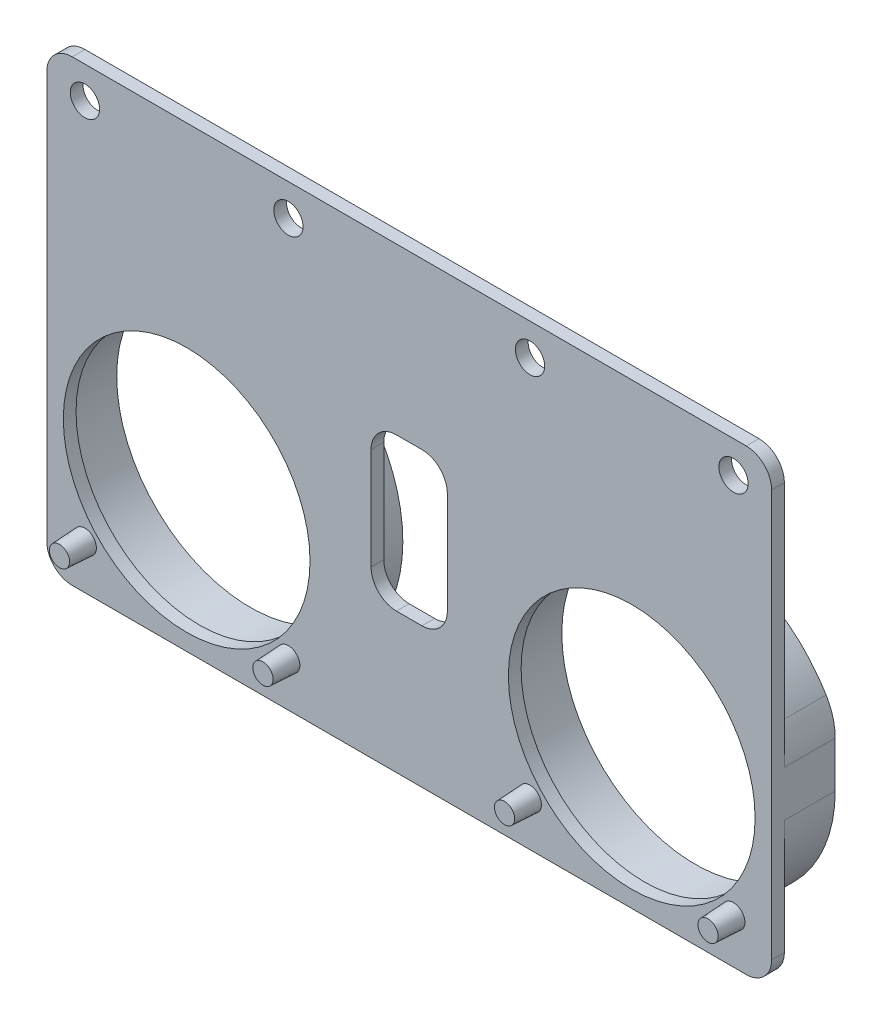
from build123d import *

# Parameters (mm, degrees)
SKETCH_1_W                = 57
SKETCH_1_H                = 36
SKETCH_1_R                = 9.7
SKETCH_1_R_2              = 1.15
SKETCH_1_W_2              = 6
SKETCH_1_H_2              = 12
EXTRUDE_1_DEPTH           = 1
FILLET_1_R                = 2
FILLET_2_R                = 2
SKETCH_2_R                = 0.9
EXTRUDE_2_DEPTH           = 2
EXTRUDE_2_DRAFT           = 3
EXTRUDE_2_PROFILE_2_DEPTH = 2
EXTRUDE_2_PROFILE_2_DRAFT = 3
MIRROR_1_COPY_1_SKETCH_R  = 0.9
MIRROR_1_COPY_1_DEPTH     = 2
MIRROR_1_COPY_1_DRAFT     = 3
MIRROR_1_COPY_2_SKETCH_R  = 0.9
MIRROR_1_COPY_2_DEPTH     = 2
MIRROR_1_COPY_2_DRAFT     = 3
MIRROR_1_COPY_3_SKETCH_R  = 0.9
MIRROR_1_COPY_3_DEPTH     = 2
MIRROR_1_COPY_3_DRAFT     = 3
SKETCH_3_R                = 10.5
EXTRUDE_3_DEPTH           = 4
FILLET_3_R                = 5


with BuildPart() as part:
    # 草图1 → 凸台-拉伸1 (new body)
    with BuildSketch(Plane.XY):
        with Locations((0, 18)):
            Rectangle(SKETCH_1_W, SKETCH_1_H)
        with Locations((17.5, 11)):
            Circle(SKETCH_1_R, mode=Mode.SUBTRACT)
        with Locations(Location((-17.5, 11, 0), (0, 0, 180))):
            Circle(SKETCH_1_R, mode=Mode.SUBTRACT)
        with Locations((25.5, 33.5)):
            Circle(SKETCH_1_R_2, mode=Mode.SUBTRACT)
        with Locations((9.5, 33.5)):
            Circle(SKETCH_1_R_2, mode=Mode.SUBTRACT)
        with Locations(Location((-9.5, 33.5, 0), (0, 0, 180))):
            Circle(SKETCH_1_R_2, mode=Mode.SUBTRACT)
        with Locations(Location((-25.5, 33.5, 0), (0, 0, 180))):
            Circle(SKETCH_1_R_2, mode=Mode.SUBTRACT)
        with Locations((0, 17)):
            Rectangle(SKETCH_1_W_2, SKETCH_1_H_2, mode=Mode.SUBTRACT)
    extrude(amount=-EXTRUDE_1_DEPTH)

    # 圆角1
    fillet_1_edges = [part.edges().sort_by_distance(p)[0] for p in [
        (28.5, 0, -0.5),
        (-28.5, 0, -0.5),
        (-28.5, 36, -0.5),
        (28.5, 36, -0.5),
    ]]
    fillet(fillet_1_edges, radius=FILLET_1_R)

    # 圆角2
    fillet_2_edges = [part.edges().sort_by_distance(p)[0] for p in [
        (-3, 11, -0.5),
        (-3, 23, -0.5),
        (3, 23, -0.5),
        (3, 11, -0.5),
    ]]
    fillet(fillet_2_edges, radius=FILLET_2_R)


with BuildPart() as extrude_2_tool:
    # 草图2 → 凸台-拉伸2 (with draft: the straight prism first)
    with BuildSketch(Plane.XY):
        with Locations((-25.5, 3.5)):
            Circle(SKETCH_2_R)
    extrude(amount=EXTRUDE_2_DEPTH)
    # 凸台-拉伸2: the draft: its side faces are tilted about the plane it starts from
    extrude_2_sides = [extrude_2_tool.faces().sort_by_distance(p)[0] for p in [
        (-26.4, 3.5, 1),
    ]]
    draft(extrude_2_sides, Plane.XY, EXTRUDE_2_DRAFT)


with BuildPart() as part_1:
    add(part.part)

    # 凸台-拉伸2: add extrude_2_tool
    add(extrude_2_tool.part)


with BuildPart() as extrude_2_profile_2_tool:
    # 草图2 → 凸台-拉伸2 profile 2 (with draft: the straight prism first)
    with BuildSketch(Plane.XY):
        with Locations((-9.5, 3.5)):
            Circle(SKETCH_2_R)
    extrude(amount=EXTRUDE_2_PROFILE_2_DEPTH)
    # 凸台-拉伸2 profile 2: the draft: its side faces are tilted about the plane it starts from
    extrude_2_profile_2_sides = [extrude_2_profile_2_tool.faces().sort_by_distance(p)[0] for p in [
        (-10.4, 3.5, 1),
    ]]
    draft(extrude_2_profile_2_sides, Plane.XY, EXTRUDE_2_PROFILE_2_DRAFT)


with BuildPart() as part_2:
    add(part_1.part)

    # 凸台-拉伸2 profile 2: add extrude_2_profile_2_tool
    add(extrude_2_profile_2_tool.part)


with BuildPart() as mirror_1_copy_1_tool:
    # 镜向1 copy 1 sketch → 镜向1 copy 1 (with draft: the straight prism first)
    with BuildSketch(Plane(origin=(0, 0, 0), x_dir=(-1, 0, 0), z_dir=(0, 0, 1))):
        with Locations((-25.5, -3.5)):
            Circle(MIRROR_1_COPY_1_SKETCH_R)
    extrude(amount=MIRROR_1_COPY_1_DEPTH)
    # 镜向1 copy 1: the draft: its side faces are tilted about the plane it starts from
    mirror_1_copy_1_sides = [mirror_1_copy_1_tool.faces().sort_by_distance(p)[0] for p in [
        (26.4, 3.5, 1),
    ]]
    draft(mirror_1_copy_1_sides, Plane(origin=(0, 0, 0), x_dir=(-1, 0, 0), z_dir=(0, 0, 1)), MIRROR_1_COPY_1_DRAFT)


with BuildPart() as part_3:
    add(part_2.part)

    # 镜向1 copy 1: add mirror_1_copy_1_tool
    add(mirror_1_copy_1_tool.part)


with BuildPart() as mirror_1_copy_2_tool:
    # 镜向1 copy 2 sketch → 镜向1 copy 2 (with draft: the straight prism first)
    with BuildSketch(Plane(origin=(0, 0, 0), x_dir=(-1, 0, 0), z_dir=(0, 0, 1))):
        with Locations((-9.5, -3.5)):
            Circle(MIRROR_1_COPY_2_SKETCH_R)
    extrude(amount=MIRROR_1_COPY_2_DEPTH)
    # 镜向1 copy 2: the draft: its side faces are tilted about the plane it starts from
    mirror_1_copy_2_sides = [mirror_1_copy_2_tool.faces().sort_by_distance(p)[0] for p in [
        (10.4, 3.5, 1),
    ]]
    draft(mirror_1_copy_2_sides, Plane(origin=(0, 0, 0), x_dir=(-1, 0, 0), z_dir=(0, 0, 1)), MIRROR_1_COPY_2_DRAFT)


with BuildPart() as part_4:
    add(part_3.part)

    # 镜向1 copy 2: add mirror_1_copy_2_tool
    add(mirror_1_copy_2_tool.part)


with BuildPart() as mirror_1_copy_3_tool:
    # 镜向1 copy 3 sketch → 镜向1 copy 3 (with draft: the straight prism first)
    with BuildSketch(Plane(origin=(0, 0, 0), x_dir=(-1, 0, 0), z_dir=(0, 0, 1))):
        with Locations((-9.5, -3.5)):
            Circle(MIRROR_1_COPY_3_SKETCH_R)
    extrude(amount=MIRROR_1_COPY_3_DEPTH)
    # 镜向1 copy 3: the draft: its side faces are tilted about the plane it starts from
    mirror_1_copy_3_sides = [mirror_1_copy_3_tool.faces().sort_by_distance(p)[0] for p in [
        (10.4, 3.5, 1),
    ]]
    draft(mirror_1_copy_3_sides, Plane(origin=(0, 0, 0), x_dir=(-1, 0, 0), z_dir=(0, 0, 1)), MIRROR_1_COPY_3_DRAFT)


with BuildPart() as part_5:
    add(part_4.part)

    # 镜向1 copy 3: add mirror_1_copy_3_tool
    add(mirror_1_copy_3_tool.part)

    # 草图3 → 凸台-拉伸3 (add)
    # profile 1 of 2: a face of its own
    with BuildSketch(Plane(origin=(0, 0, -1), x_dir=(-1, 0, 0), z_dir=(0, 0, -1))):
        with BuildLine():
            ThreePointArc((-12.704168477, 0), (-9.014718626, 19.485281374), (-28.5, 15.795831523))
            Line((-28.5, 15.795831523), (-28.5, 11))
            ThreePointArc((-28.5, 11), (-25.278174593, 3.221825407), (-17.5, 0))
            Line((-17.5, 0), (-12.704168477, 0))
        make_face()
        with Locations((-17.5, 11)):
            Circle(SKETCH_3_R, mode=Mode.SUBTRACT)
    # profile 2 of 2: a face of its own
    with BuildSketch(Plane(origin=(0, 0, -1), x_dir=(-1, 0, 0), z_dir=(0, 0, -1))):
        with BuildLine():
            ThreePointArc((28.5, 15.795831523), (9.014718626, 19.485281374), (12.704168477, 0))
            Line((12.704168477, 0), (17.5, 0))
            ThreePointArc((17.5, 0), (25.278174593, 3.221825407), (28.5, 11))
            Line((28.5, 11), (28.5, 15.795831523))
        make_face()
        with Locations((17.5, 11)):
            Circle(SKETCH_3_R, mode=Mode.SUBTRACT)
    extrude(amount=EXTRUDE_3_DEPTH)

    # 圆角3
    fillet_3_edges = [part_5.edges().sort_by_distance(p)[0] for p in [
        (28.5, 15.795831523, -3),
        (12.704168477, 0, -3),
        (-12.704168477, 0, -3),
        (-28.5, 15.795831523, -3),
    ]]
    fillet(fillet_3_edges, radius=FILLET_3_R)


solid = part_5.part
